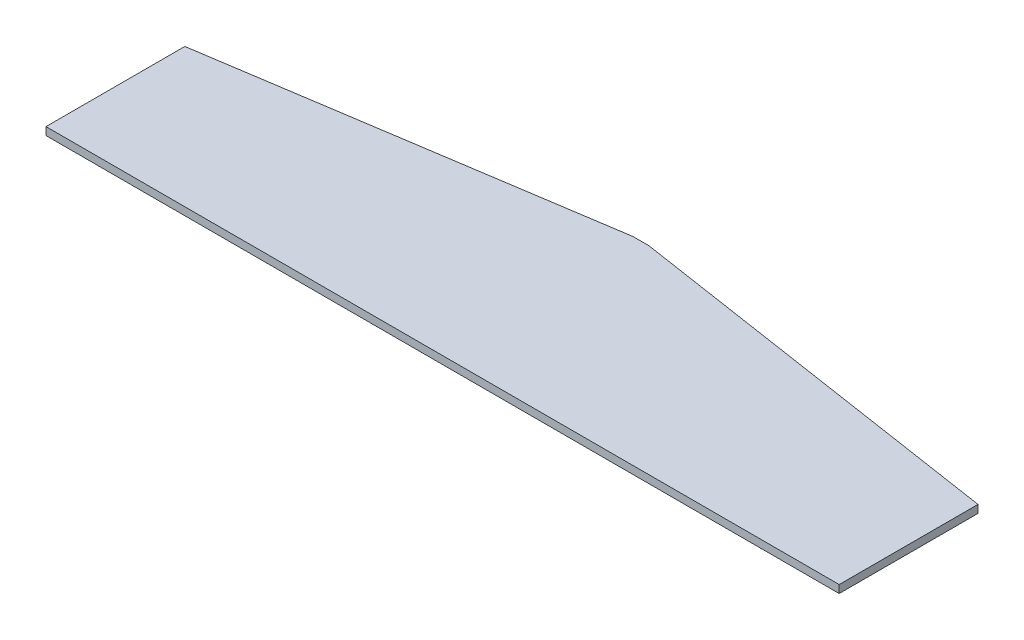
from build123d import *

# Parameters (mm, degrees)
BOSS_EXTRUDE1_DEPTH = 5


with BuildPart() as part:
    # Sketch1 → Boss-Extrude1 (new body)
    with BuildSketch(Plane(origin=(0, 0, 0), x_dir=(1, 0, 0), z_dir=(0, 1, 0))):
        Polygon((0, 0), (10.16, 0), (259.08, -38.1), (259.08, -127), (-248.92, -127), (-248.92, -38.1), align=None)
    extrude(amount=BOSS_EXTRUDE1_DEPTH)


solid = part.part
